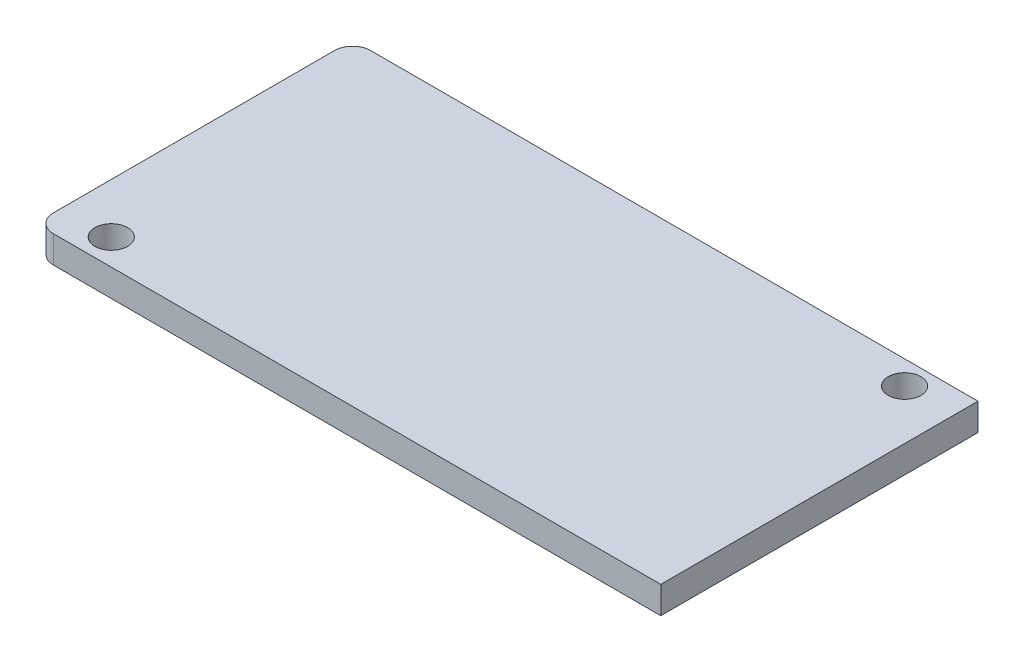
from build123d import *

# Parameters (mm, degrees)
SKETCH1_W           = 69
SKETCH1_H           = 35
BOSS_EXTRUDE1_DEPTH = 3
FILLET4_R           = 2
CUT_EXTRUDE1_REACH  = 40.801
SKETCH2_R           = 1.8


with BuildPart() as part:
    # Sketch1 → Boss-Extrude1 (new body)
    with BuildSketch(Plane(origin=(0, 0, 0), x_dir=(1, 0, 0), z_dir=(0, 1, 0))):
        Rectangle(SKETCH1_W, SKETCH1_H)
    extrude(amount=BOSS_EXTRUDE1_DEPTH)

    # Fillet4
    fillet4_edges = [part.edges().sort_by_distance(p)[0] for p in [
        (-34.5, 1.5, 17.5),
        (-34.5, 1.5, -17.5),
    ]]
    fillet(fillet4_edges, radius=FILLET4_R)

    # Sketch2 → Cut-Extrude1 (cut, up to next)
    with BuildSketch(Plane.XZ, mode=Mode.PRIVATE) as cut_extrude1_sk1:
        with Locations(Location((-29, 14.625, 0), (0, 0, 270))):
            Circle(SKETCH2_R)
    cut_extrude1_tool1 = extrude(cut_extrude1_sk1.sketch, amount=-CUT_EXTRUDE1_REACH, mode=Mode.PRIVATE) & part.part
    # Sketch2 → Cut-Extrude1 (cut, up to next)
    with BuildSketch(Plane.XZ, mode=Mode.PRIVATE) as cut_extrude1_sk2:
        with Locations(Location((29, -14.898327821, 0), (0, 0, 270))):
            Circle(SKETCH2_R)
    cut_extrude1_tool2 = extrude(cut_extrude1_sk2.sketch, amount=-CUT_EXTRUDE1_REACH, mode=Mode.PRIVATE) & part.part
    add(cut_extrude1_tool1.solids().sort_by_distance((-29, 0, 14.625))[0], mode=Mode.SUBTRACT)
    add(cut_extrude1_tool2.solids().sort_by_distance((29, 0, -14.898328))[0], mode=Mode.SUBTRACT)


solid = part.part
